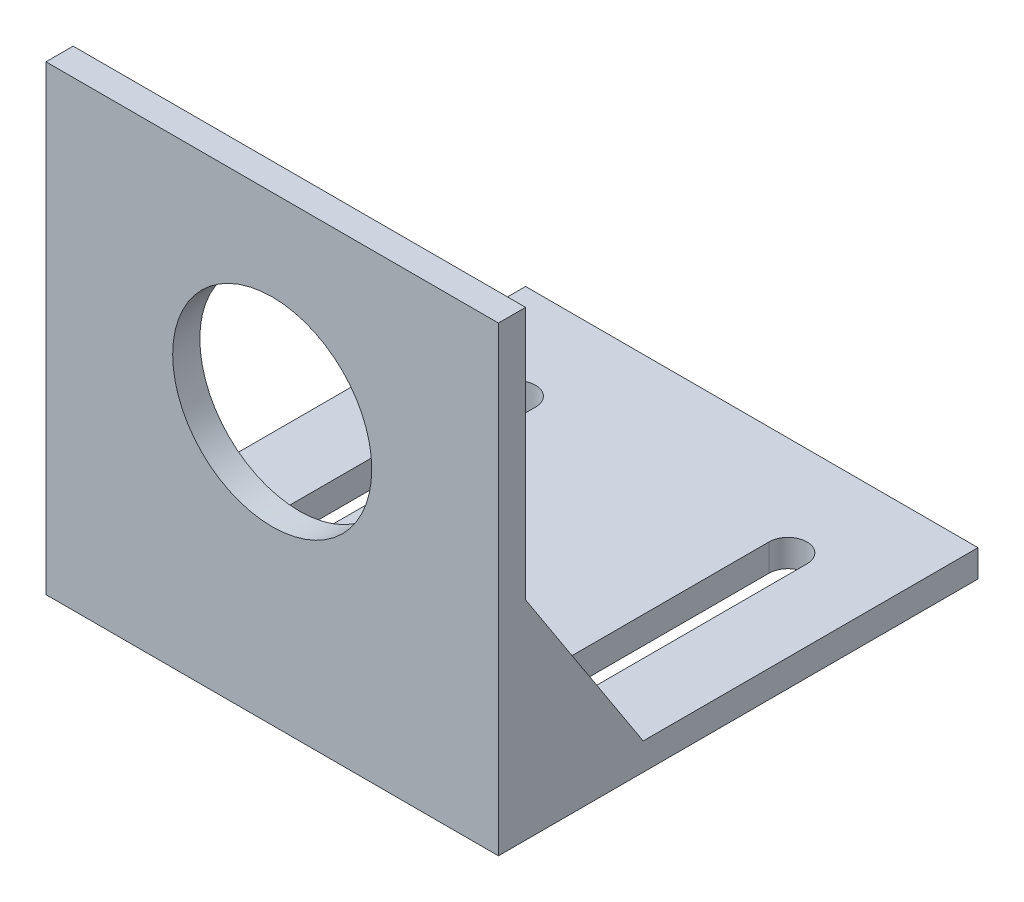
from build123d import *

# Parameters (mm, degrees)
SKETCH2_W           = 50
SKETCH2_H           = 53
BOSS_EXTRUDE1_DEPTH = 3
SKETCH3_W           = 50
SKETCH3_H           = 48
SKETCH3_R           = 11
BOSS_EXTRUDE2_DEPTH = 3
BOSS_EXTRUDE3_DEPTH = 3


with BuildPart() as part:
    # Sketch2 → Boss-Extrude1 (new body)
    with BuildSketch(Plane(origin=(0, 0, 0), x_dir=(1, 0, 0), z_dir=(0, 1, 0))):
        with Locations((25, 26.5)):
            Rectangle(SKETCH2_W, SKETCH2_H)
        with BuildLine():
            Line((7.9, 12), (7.9, 42))
            ThreePointArc((7.9, 42), (10, 44.1), (12.1, 42))
            Line((12.1, 42), (12.1, 12))
            ThreePointArc((12.1, 12), (10, 9.9), (7.9, 12))
        make_face(mode=Mode.SUBTRACT)
        with BuildLine():
            Line((42.1, 12), (42.1, 42))
            ThreePointArc((42.1, 42), (40, 44.1), (37.9, 42))
            Line((37.9, 42), (37.9, 12))
            ThreePointArc((37.9, 12), (40, 9.9), (42.1, 12))
        make_face(mode=Mode.SUBTRACT)
    extrude(amount=BOSS_EXTRUDE1_DEPTH)

    # Sketch3 → Boss-Extrude2 (add)
    with BuildSketch(Plane.XY):
        with Locations((25, 27)):
            Rectangle(SKETCH3_W, SKETCH3_H)
        with Locations((25, 30)):
            Circle(SKETCH3_R, mode=Mode.SUBTRACT)
    extrude(amount=-BOSS_EXTRUDE2_DEPTH)

    # Sketch4 → Boss-Extrude3 (add)
    with BuildSketch(Plane(origin=(50, 0, 0), x_dir=(0, 0, -1), z_dir=(1, 0, 0))):
        Polygon((16, 3), (3, 23), (3, 3), align=None)
    boss_extrude3 = extrude(amount=-BOSS_EXTRUDE3_DEPTH)

    # Mirror1: Boss-Extrude3 across plane
    add(boss_extrude3.mirror(Plane.ZY.offset(-25)))


solid = part.part
